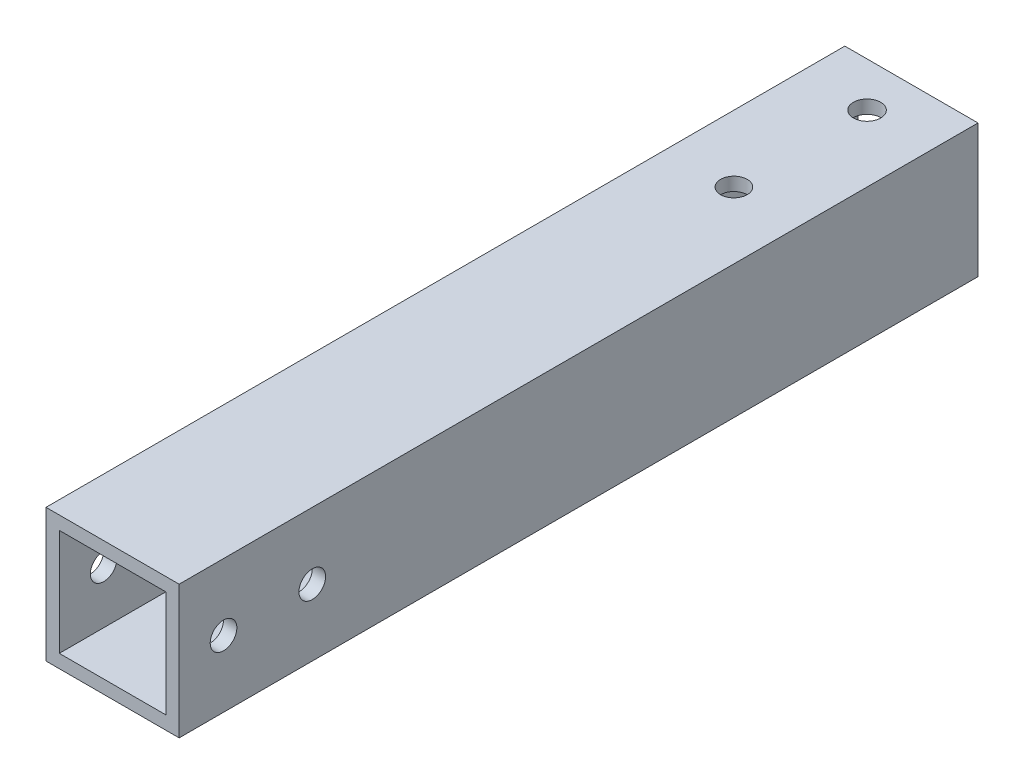
from build123d import *

# Parameters (mm, degrees)
ESQUISSE1_W             = 15
ESQUISSE1_H             = 15
EXTRUSION1_DEPTH        = 90
ESQUISSE2_W             = 12
ESQUISSE2_H             = 12
EXTRUSION2_DEPTH        = 91.622844802
ESQUISSE3_R             = 1.5
ENL_V_MAT_EXTRU_1_DEPTH = 92.549167118
ESQUISSE4_R             = 1.5
ESQUISSE4_R_2           = 1.538778498
ENL_V_MAT_EXTRU_2_DEPTH = 92.549167118


with BuildPart() as part:
    # Esquisse1 → Extrusion1 (new body)
    with BuildSketch(Plane.XY):
        Rectangle(ESQUISSE1_W, ESQUISSE1_H)
    extrude(amount=EXTRUSION1_DEPTH)

    # Esquisse2 → Extrusion2 (cut, through all)
    with BuildSketch(Plane.XY.offset(90)):
        Rectangle(ESQUISSE2_W, ESQUISSE2_H)
    extrude(amount=-EXTRUSION2_DEPTH, mode=Mode.SUBTRACT)

    # Esquisse3 → Enlèv. mat.-Extru.1 (cut, through all)
    with BuildSketch(Plane(origin=(7.5, 0, 0), x_dir=(0, 0, -1), z_dir=(1, 0, 0))):
        with Locations((-85, 0)):
            Circle(ESQUISSE3_R)
        with Locations((-75, 0)):
            Circle(ESQUISSE3_R)
    extrude(amount=-ENL_V_MAT_EXTRU_1_DEPTH, mode=Mode.SUBTRACT)

    # Esquisse4 → Enlèv. mat.-Extru.2 (cut, through all)
    with BuildSketch(Plane(origin=(0, 7.5, 0), x_dir=(1, 0, 0), z_dir=(0, 1, 0))):
        with Locations(Location((0, -20, 0), (0, 0, 270))):
            Circle(ESQUISSE4_R)
        with Locations(Location((0, -5, 0), (0, 0, 270))):
            Circle(ESQUISSE4_R_2)
    extrude(amount=-ENL_V_MAT_EXTRU_2_DEPTH, mode=Mode.SUBTRACT)


solid = part.part
